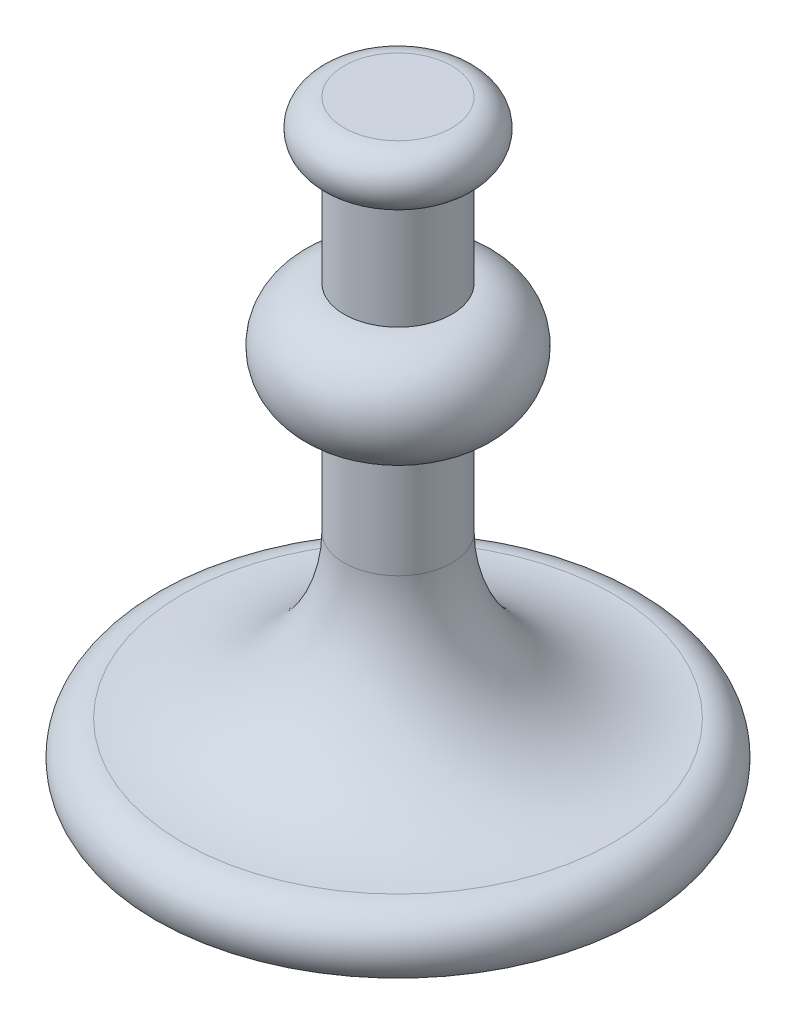
from build123d import *


with BuildPart() as part:
    # Эскиз1 → Повернуть1 (revolve)
    with BuildSketch(Plane.XY, mode=Mode.PRIVATE) as revolve_1_sk:
        with BuildLine():
            Line((0, 0), (0, 220))
            Line((0, 220), (20, 220))
            ThreePointArc((20, 220), (30, 210), (20, 200))
            Line((20, 200), (20, 160))
            ThreePointArc((20, 160), (40, 140), (20, 120))
            Line((20, 120), (20, 80))
            ThreePointArc((20, 80), (37.573593129, 37.573593129), (80, 20))
            ThreePointArc((80, 20), (91.180339887, 13.090169944), (90, 0))
            Line((90, 0), (0, 0))
        make_face()
    revolve(revolve_1_sk.sketch.rotate(Axis((0, 0, 0), (0, 1, 0)), 90), axis=Axis((0, 0, 0), (0, 1, 0)))


solid = part.part
